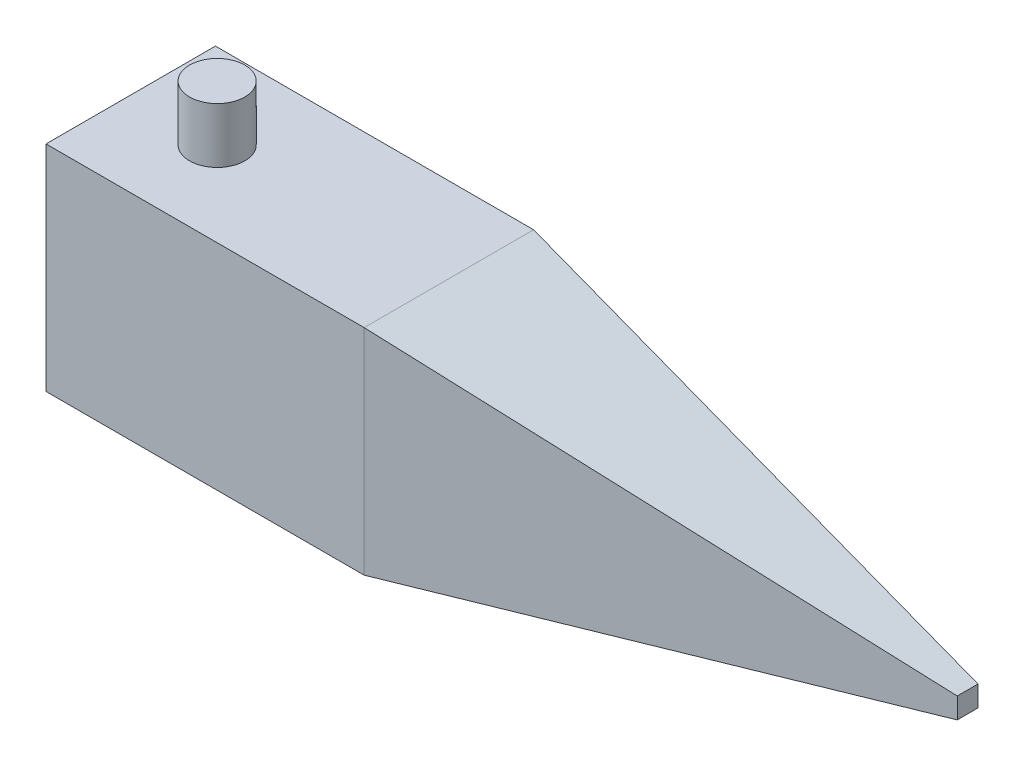
from build123d import *

# Parameters (mm, degrees)
SKETCH1_W           = 46
SKETCH1_H           = 24.5
BODY_DEPTH          = 31
SKETCH3_W           = 42
SKETCH3_H           = 20.5
SERVO_HOLE_DEPTH    = 29
CUT_EXTRUDE3_DEPTH  = 29
SKETCH6_R           = 4
BOSS_EXTRUDE3_DEPTH = 8


with BuildPart() as part:
    # Sketch1 → Body (new body)
    with BuildSketch(Plane(origin=(0, 0, 0), x_dir=(1, 0, 0), z_dir=(0, 1, 0))):
        Rectangle(SKETCH1_W, SKETCH1_H)
    extrude(amount=BODY_DEPTH)

    # Sketch3 → Servo Hole (cut)
    with BuildSketch(Plane(origin=(0, 0, 0), x_dir=(1, 0, 0), z_dir=(0, 1, 0))):
        Rectangle(SKETCH3_W, SKETCH3_H)
    extrude(amount=SERVO_HOLE_DEPTH, mode=Mode.SUBTRACT)

    # Point → section 0 of loft1
    with BuildSketch(Plane(origin=(98, 0, 0), x_dir=(0, 0, -1), z_dir=(1, 0, 0)), mode=Mode.PRIVATE) as loft1_s0:
        with BuildLine():
            Line((-1.5, 14), (1.5, 14))
            Line((1.5, 14), (1.5, 17))
            Line((1.5, 17), (-1.5, 17))
            Line((-1.5, 17), (-1.5, 14))
        make_face()
    # loft up to a face of the part (loft1)
    loft([loft1_s0.sketch, part.faces().sort_by_distance((23, 15.5, 0))[0]])

    # Sketch5 → Cut-Extrude3 (cut)
    with BuildSketch(Plane.ZY.offset(23)):
        Polygon((-6, 27), (6, 27), (6, 22), (4.5, 22), (4.5, 2), (-4.5, 2), (-4.5, 22), (-6, 22), align=None)
    extrude(amount=-CUT_EXTRUDE3_DEPTH, mode=Mode.SUBTRACT)

    # Sketch6 → Boss-Extrude3 (add)
    with BuildSketch(Plane(origin=(0, 31, 0), x_dir=(1, 0, 0), z_dir=(0, 1, 0))):
        with Locations(Location((-10.5, 0, 0), (0, 0, 90))):
            Circle(SKETCH6_R)
    extrude(amount=BOSS_EXTRUDE3_DEPTH)


solid = part.part
